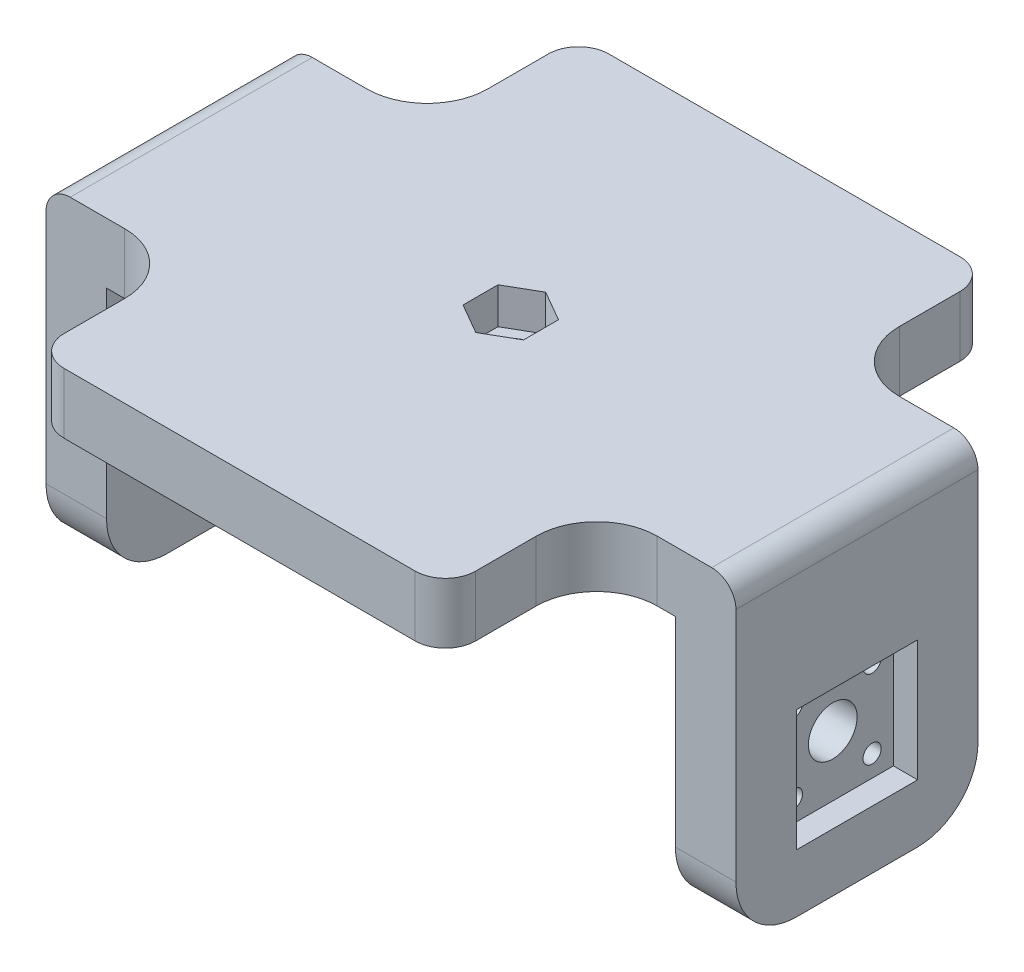
from build123d import *

# Parameters (mm, degrees)
BOSS_EXTRUDE1_DEPTH     = 40
SKETCH2_R               = 12.5
CUT_EXTRUDE1_DEPTH      = 4.4775
FILLET1_R               = 10
CUT_EXTRUDE2_DEPTH      = 131.2
CUT_EXTRUDE2_DEPTH_BACK = 14.2
SKETCH4_R               = 2.5
SKETCH6_W               = 68
SKETCH6_H               = 90
BOSS_EXTRUDE4_DEPTH     = 10
FILLET2_R               = 10
FILLET3_R               = 5
FILLET4_R               = 4
CUT_EXTRUDE3_START      = -2.2025
SKETCH7_R               = 3.9
CUT_EXTRUDE3_DEPTH      = 0.85
SKETCH8_R               = 3.25
CUT_EXTRUDE4_DEPTH      = 10
SKETCH9_R               = 4.025
CUT_EXTRUDE5_DEPTH      = 12
SKETCH10_W              = 20.05
SKETCH10_H              = 20.05
CUT_EXTRUDE6_DEPTH      = 4
CUT_EXTRUDE7_DEPTH      = 6
CUT_EXTRUDE9_DEPTH      = 2.5
CUT_EXTRUDE10_REACH     = 138.104
CUT_EXTRUDE10_START     = 2.5
SKETCH15_R              = 1.5


with BuildPart() as part:
    # Sketch1 → Boss-Extrude1 (new body)
    with BuildSketch(Plane.XY):
        Polygon((10, 0), (10, 43), (104, 43), (104, 0), (114, 0), (114, 53), (0, 53), (0, 0), align=None)
    extrude(amount=-BOSS_EXTRUDE1_DEPTH)

    # Sketch2 → Cut-Extrude1 (cut)
    with BuildSketch(Plane(origin=(10, 0, 0), x_dir=(0, 0, -1), z_dir=(1, 0, 0))):
        with Locations((20, 19.635146369)):
            Circle(SKETCH2_R)
    extrude(amount=-CUT_EXTRUDE1_DEPTH, mode=Mode.SUBTRACT)

    # Fillet1
    fillet1_edges = [part.edges().sort_by_distance(p)[0] for p in [
        (5, 0, 0),
        (109, 0, -40),
        (5, 0, -40),
        (109, 0, 0),
    ]]
    fillet(fillet1_edges, radius=FILLET1_R)

    # Sketch4 → Cut-Extrude2 (cut, two sides: drawn at the far end of the back side and taken through both)
    with BuildSketch(Plane(origin=(7.725, 0, 0), x_dir=(0, 0, -1), z_dir=(1, 0, 0)).offset(-CUT_EXTRUDE2_DEPTH_BACK)):
        with Locations(Location((20, 19.635146369, 0), (0, 0, 180))):
            Circle(SKETCH4_R)
    extrude(amount=CUT_EXTRUDE2_DEPTH + CUT_EXTRUDE2_DEPTH_BACK, mode=Mode.SUBTRACT)

    # Sketch6 → Boss-Extrude4 (add)
    with BuildSketch(Plane(origin=(0, 53, 0), x_dir=(1, 0, 0), z_dir=(0, 1, 0))):
        with Locations((57, 20)):
            Rectangle(SKETCH6_W, SKETCH6_H)
    extrude(amount=-BOSS_EXTRUDE4_DEPTH)

    # Fillet2
    fillet2_edges = [part.edges().sort_by_distance(p)[0] for p in [
        (23, 48, 0),
        (91, 48, 0),
        (91, 48, -40),
        (23, 48, -40),
    ]]
    fillet(fillet2_edges, radius=FILLET2_R)

    # Fillet3
    fillet3_edges = [part.edges().sort_by_distance(p)[0] for p in [
        (23, 48, 25),
        (91, 48, -65),
        (91, 48, 25),
        (23, 48, -65),
    ]]
    fillet(fillet3_edges, radius=FILLET3_R)

    # Fillet4
    fillet4_edges = [part.edges().sort_by_distance(p)[0] for p in [
        (0, 53, -20),
        (114, 53, -20),
    ]]
    fillet(fillet4_edges, radius=FILLET4_R)

    # Sketch7 → Cut-Extrude3 (cut)
    with BuildSketch(Plane(origin=(7.725, 0, 0), x_dir=(0, 0, -1), z_dir=(1, 0, 0)).offset(CUT_EXTRUDE3_START)):
        with Locations((20, 19.635146369)):
            Circle(SKETCH7_R)
    extrude(amount=-CUT_EXTRUDE3_DEPTH, mode=Mode.SUBTRACT)

    # Sketch8 → Cut-Extrude4 (cut)
    with BuildSketch(Plane(origin=(0, 53, 0), x_dir=(1, 0, 0), z_dir=(0, 1, 0))):
        with Locations(Location((57, 20, 0), (0, 0, 270))):
            Circle(SKETCH8_R)
    extrude(amount=-CUT_EXTRUDE4_DEPTH, mode=Mode.SUBTRACT)

    # Sketch9 → Cut-Extrude5 (cut)
    with BuildSketch(Plane(origin=(114, 0, 0), x_dir=(0, 0, -1), z_dir=(1, 0, 0))):
        with Locations(Location((20, 19.635146369, 0), (0, 0, 90))):
            Circle(SKETCH9_R)
    extrude(amount=-CUT_EXTRUDE5_DEPTH, mode=Mode.SUBTRACT)

    # Sketch10 → Cut-Extrude6 (cut)
    with BuildSketch(Plane(origin=(114, 0, 0), x_dir=(0, 0, -1), z_dir=(1, 0, 0))):
        with Locations((20, 19.635146369)):
            Rectangle(SKETCH10_W, SKETCH10_H)
    extrude(amount=-CUT_EXTRUDE6_DEPTH, mode=Mode.SUBTRACT)

    # Sketch14 → Cut-Extrude7 (cut)
    with BuildSketch(Plane(origin=(0, 53, 0), x_dir=(1, 0, 0), z_dir=(0, 1, 0))):
        Polygon((56.872881106, 25.694991584), (61.872881106, 22.808240238), (61.872881106, 17.034737546), (56.872881106, 14.1479862), (51.872881106, 17.034737546), (51.872881106, 22.808240238), align=None)
    extrude(amount=-CUT_EXTRUDE7_DEPTH, mode=Mode.SUBTRACT)

    # Sketch18 → Cut-Extrude9 (cut)
    with BuildSketch(Plane.ZY.offset(-104)):
        Polygon((-15.048857438, 28.91356654), (-11.910134999, 28.91356654), (-10.270487153, 26.081726401), (-11.891583597, 23.249886262), (-15.151000849, 23.249886262), (-16.733963505, 26.081726401), align=None)
        Polygon((-23.266036495, 26.081726401), (-24.951142562, 28.91356654), (-28.089865001, 28.91356654), (-29.729512847, 26.081726401), (-28.108416403, 23.249886262), (-24.848999151, 23.249886262), align=None)
        Polygon((-16.733963505, 13.188566337), (-15.048857438, 10.356726198), (-11.910134999, 10.356726198), (-10.270487153, 13.188566337), (-11.891583597, 16.020406476), (-15.151000849, 16.020406476), align=None)
        Polygon((-24.848999151, 16.020406476), (-23.266036495, 13.188566337), (-24.951142562, 10.356726198), (-28.089865001, 10.356726198), (-29.729512847, 13.188566337), (-28.108416403, 16.020406476), align=None)
    extrude(amount=-CUT_EXTRUDE9_DEPTH, mode=Mode.SUBTRACT)

    # Sketch15 → Cut-Extrude10 (cut, up to next)
    with BuildSketch(Plane.ZY.offset(-104).offset(CUT_EXTRUDE10_START), mode=Mode.PRIVATE) as cut_extrude10_sk1:
        with Locations(Location((-26.5, 26.135146369, 0), (0, 0, 270))):
            Circle(SKETCH15_R)
    cut_extrude10_tool1 = extrude(cut_extrude10_sk1.sketch, amount=-CUT_EXTRUDE10_REACH, mode=Mode.PRIVATE) & part.part
    # Sketch15 → Cut-Extrude10 (cut, up to next)
    with BuildSketch(Plane.ZY.offset(-104).offset(CUT_EXTRUDE10_START), mode=Mode.PRIVATE) as cut_extrude10_sk2:
        with Locations(Location((-13.5, 26.135146369, 0), (0, 0, 270))):
            Circle(SKETCH15_R)
    cut_extrude10_tool2 = extrude(cut_extrude10_sk2.sketch, amount=-CUT_EXTRUDE10_REACH, mode=Mode.PRIVATE) & part.part
    # Sketch15 → Cut-Extrude10 (cut, up to next)
    with BuildSketch(Plane.ZY.offset(-104).offset(CUT_EXTRUDE10_START), mode=Mode.PRIVATE) as cut_extrude10_sk3:
        with Locations(Location((-13.5, 13.135146369, 0), (0, 0, 270))):
            Circle(SKETCH15_R)
    cut_extrude10_tool3 = extrude(cut_extrude10_sk3.sketch, amount=-CUT_EXTRUDE10_REACH, mode=Mode.PRIVATE) & part.part
    # Sketch15 → Cut-Extrude10 (cut, up to next)
    with BuildSketch(Plane.ZY.offset(-104).offset(CUT_EXTRUDE10_START), mode=Mode.PRIVATE) as cut_extrude10_sk4:
        with Locations(Location((-26.5, 13.135146369, 0), (0, 0, 270))):
            Circle(SKETCH15_R)
    cut_extrude10_tool4 = extrude(cut_extrude10_sk4.sketch, amount=-CUT_EXTRUDE10_REACH, mode=Mode.PRIVATE) & part.part
    add(cut_extrude10_tool1.solids().sort_by_distance((101.5, 26.135146, -26.5))[0], mode=Mode.SUBTRACT)
    add(cut_extrude10_tool2.solids().sort_by_distance((101.5, 26.135146, -13.5))[0], mode=Mode.SUBTRACT)
    add(cut_extrude10_tool3.solids().sort_by_distance((101.5, 13.135146, -13.5))[0], mode=Mode.SUBTRACT)
    add(cut_extrude10_tool4.solids().sort_by_distance((101.5, 13.135146, -26.5))[0], mode=Mode.SUBTRACT)


solid = part.part
